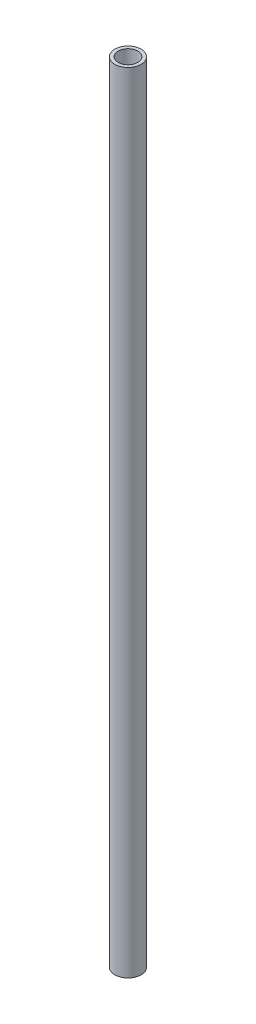
from build123d import *

# Parameters (mm, degrees)
SKETCH1_R           = 1
BOSS_EXTRUDE1_DEPTH = 60
SKETCH2_R           = 0.75
CUT_EXTRUDE1_DEPTH  = 60


with BuildPart() as part:
    # Sketch1 → Boss-Extrude1 (new body)
    with BuildSketch(Plane(origin=(0, 0, 0), x_dir=(1, 0, 0), z_dir=(0, 1, 0))):
        with Locations(Location((0, 0, 0), (0, 0, 270))):
            Circle(SKETCH1_R)
    extrude(amount=BOSS_EXTRUDE1_DEPTH)

    # Sketch2 → Cut-Extrude1 (cut)
    with BuildSketch(Plane.XZ):
        with Locations(Location((0, 0, 0), (0, 0, 270))):
            Circle(SKETCH2_R)
    extrude(amount=-CUT_EXTRUDE1_DEPTH, mode=Mode.SUBTRACT)


solid = part.part
